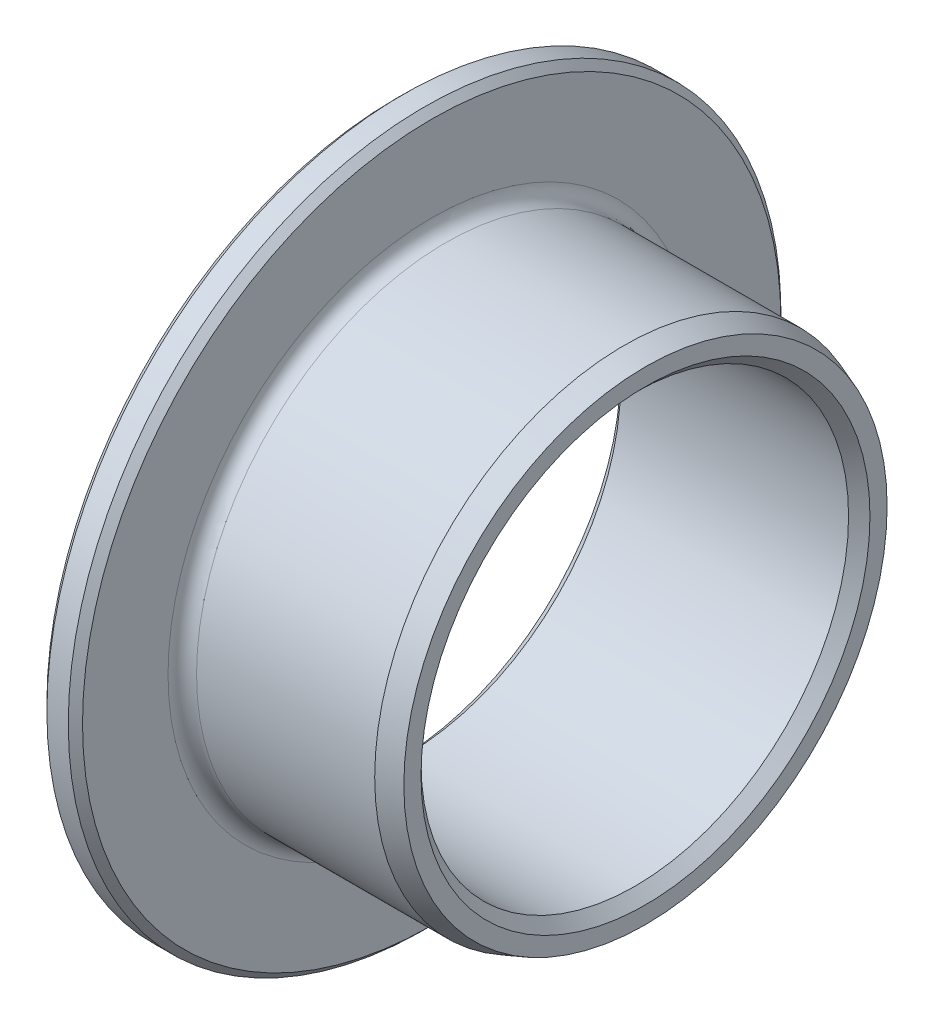
from build123d import *

# Parameters (mm, degrees)
CHANFREIN2_SIZE  = 0.6
CHANFREIN2_SIZE2 = 0.218382141
CHANFREIN3_SIZE  = 0.3
CHANFREIN4_SIZE  = 0.2
CONG_1_R         = 0.4


with BuildPart() as part:
    # Esquisse1 → Base-Révolution (revolve)
    with BuildSketch(Plane.XY, mode=Mode.PRIVATE) as base_r_volution_sk:
        Polygon((-1, 6), (-1, 10), (0, 10), (0, 7), (6, 7), (6, 6), align=None)
    revolve(base_r_volution_sk.sketch.rotate(Axis((-5.312682662, 0, 0), (1, 0, 0)), 90), axis=Axis((-5.312682662, 0, 0), (1, 0, 0)))

    # Chanfrein2
    chanfrein2_edges = [part.edges().sort_by_distance(p)[0] for p in [
        (6, 0, -7),
    ]]
    chanfrein2_side = [part.faces().sort_by_distance(p)[0] for p in [
        (3, 0, -7),
    ]]
    chamfer(chanfrein2_edges, length=CHANFREIN2_SIZE, length2=CHANFREIN2_SIZE2, reference=chanfrein2_side[0])

    # Chanfrein3
    chanfrein3_edges = [part.edges().sort_by_distance(p)[0] for p in [
        (-1, 0, -6),
        (6, 0, -6),
    ]]
    chamfer(chanfrein3_edges, length=CHANFREIN3_SIZE)

    # Chanfrein4
    chanfrein4_edges = [part.edges().sort_by_distance(p)[0] for p in [
        (0, 0, -10),
        (-1, 0, -10),
    ]]
    chamfer(chanfrein4_edges, length=CHANFREIN4_SIZE)

    # Congé1
    cong_1_edges = [part.edges().sort_by_distance(p)[0] for p in [
        (0, 0, -7),
    ]]
    fillet(cong_1_edges, radius=CONG_1_R)


solid = part.part
